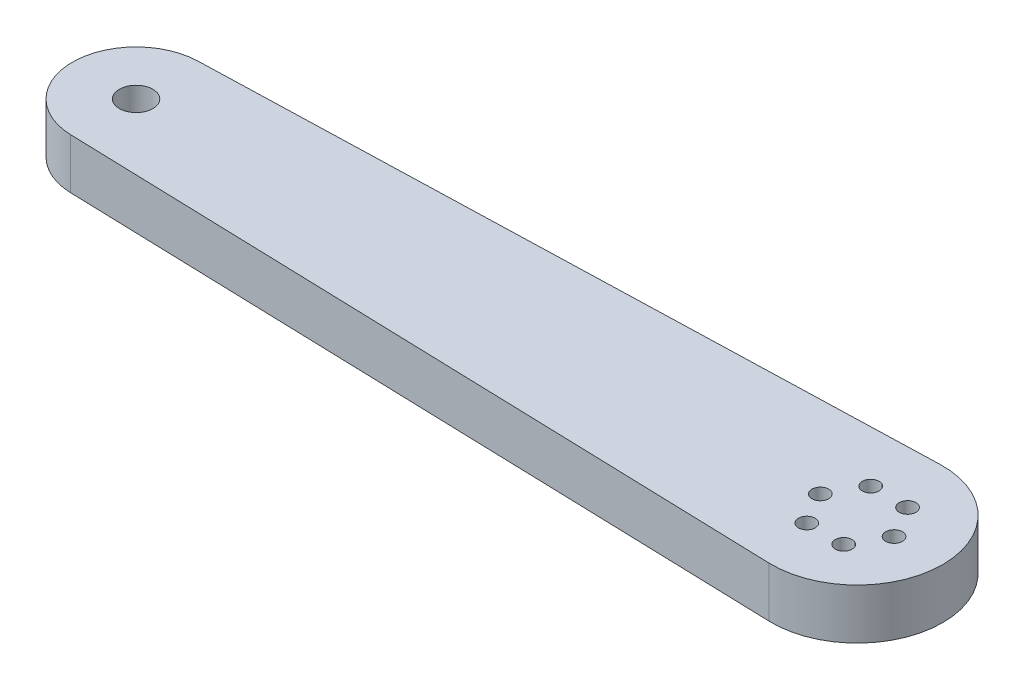
from build123d import *

# Parameters (mm, degrees)
SKETCH_1_R      = 5
SKETCH_1_R_2    = 2.5
EXTRUDE_1_DEPTH = 15


with BuildPart() as part:
    # 草图1 → 凸台-拉伸1 (new body)
    with BuildSketch(Plane(origin=(0, 0, 0), x_dir=(1, 0, 0), z_dir=(0, 1, 0))):
        with BuildLine():
            Line((-0.574418605, 18.991314943), (214.229069767, 25.488343739))
            ThreePointArc((214.229069767, 25.488343739), (240.5, 0), (214.229069767, -25.488343739))
            Line((214.229069767, -25.488343739), (-0.574418605, -18.991314943))
            ThreePointArc((-0.574418605, -18.991314943), (-19, 0), (-0.574418605, 18.991314943))
        make_face()
        with Locations(Location((0, 0, 0), (0, 0, 270))):
            Circle(SKETCH_1_R, mode=Mode.SUBTRACT)
        with Locations(Location((209.5, 9.526279442, 0), (0, 0, 270))):
            Circle(SKETCH_1_R_2, mode=Mode.SUBTRACT)
        with Locations(Location((220.5, 9.526279442, 0), (0, 0, 270))):
            Circle(SKETCH_1_R_2, mode=Mode.SUBTRACT)
        with Locations(Location((226, 0, 0), (0, 0, 270))):
            Circle(SKETCH_1_R_2, mode=Mode.SUBTRACT)
        with Locations(Location((220.5, -9.526279442, 0), (0, 0, 270))):
            Circle(SKETCH_1_R_2, mode=Mode.SUBTRACT)
        with Locations(Location((209.5, -9.526279442, 0), (0, 0, 270))):
            Circle(SKETCH_1_R_2, mode=Mode.SUBTRACT)
        with Locations(Location((204, 0, 0), (0, 0, 270))):
            Circle(SKETCH_1_R_2, mode=Mode.SUBTRACT)
    extrude(amount=EXTRUDE_1_DEPTH)


solid = part.part
